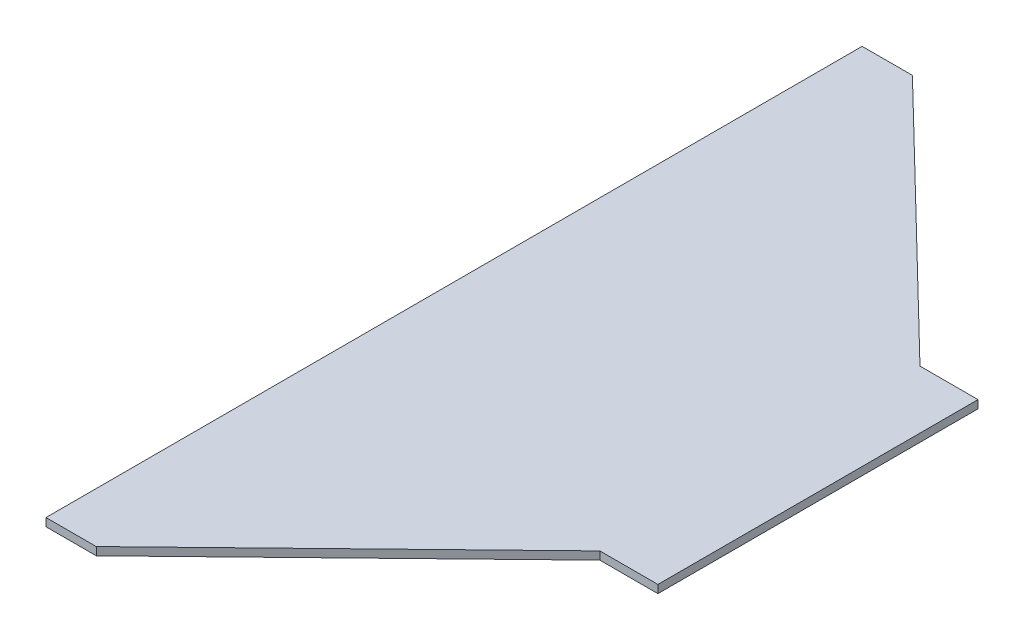
from build123d import *

# Parameters (mm, degrees)
SALIENTE_EXTRUIR1_DEPTH = 1


with BuildPart() as part:
    # Croquis1 → Saliente-Extruir1 (new body)
    with BuildSketch(Plane(origin=(0, 0, 0), x_dir=(1, 0, 0), z_dir=(0, 1, 0))):
        Polygon((0, 0), (0, -101.83), (6.27, -101.83), (38.16, -70.885), (45.4, -70.885), (45.4, -30.945), (38.16, -30.945), (6.27, 0), align=None)
    extrude(amount=SALIENTE_EXTRUIR1_DEPTH)


solid = part.part
